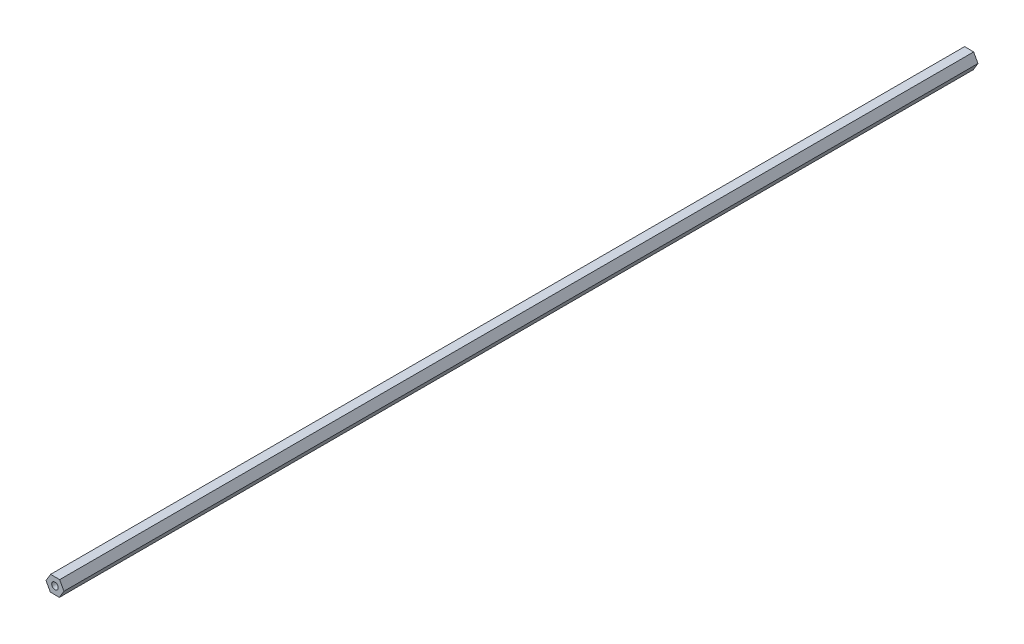
from build123d import *

# Parameters (mm, degrees)
SKETCH1_R           = 2.667
BOSS_EXTRUDE1_DEPTH = 746.76


with BuildPart() as part:
    # Sketch1 → Boss-Extrude1 (new body)
    with BuildSketch(Plane.XY):
        Polygon((3.554783558, -6.413021689), (7.331231477, -0.127977978), (3.776447919, 6.285043711), (-3.554783558, 6.413021689), (-7.331231477, 0.127977978), (-3.776447919, -6.285043711), align=None)
        with Locations(Location((0, 0, 0), (0, 0, 180))):
            Circle(SKETCH1_R, mode=Mode.SUBTRACT)
    extrude(amount=BOSS_EXTRUDE1_DEPTH)


solid = part.part
